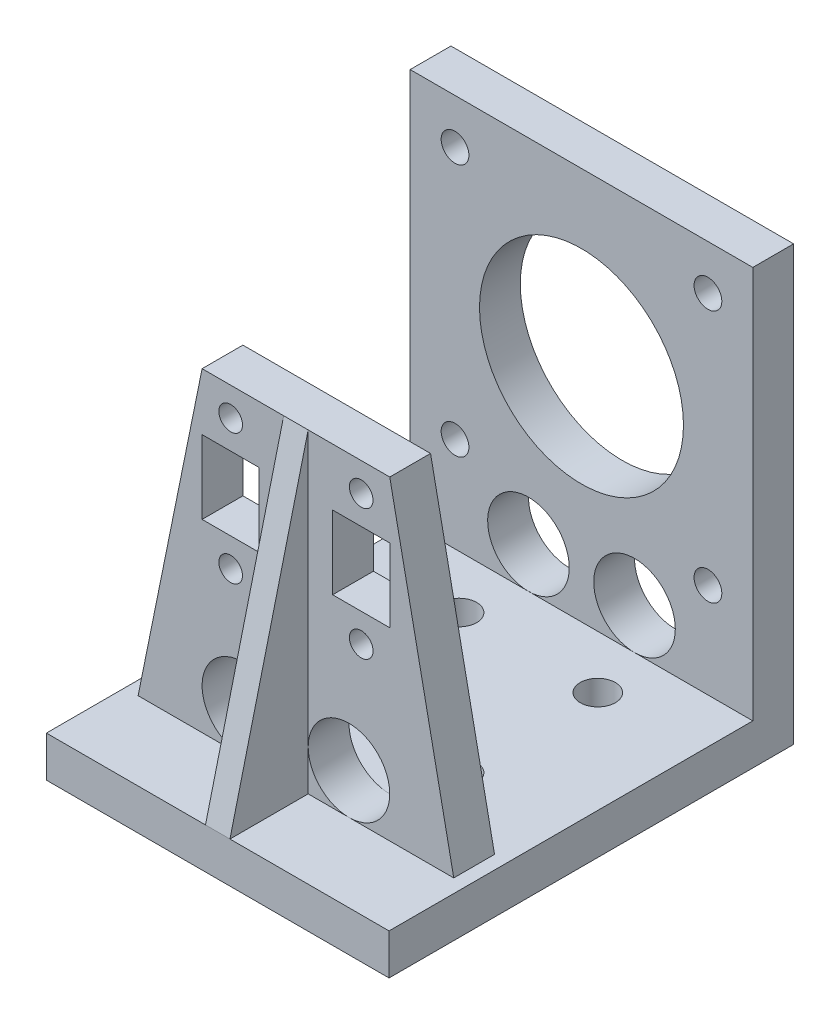
from build123d import *

# Parameters (mm, degrees)
MOTOR_MOUNT_SOLID_DEPTH                   = 7.5
ENCODER_DISTANCE_SKETCH_W                 = 50
ENCODER_DISTANCE_SKETCH_H                 = 45
ENCODER_DISTANCE_SOLID_DEPTH              = 5
ENCODER_MOUNT_SKETCH_R                    = 1.45
ENCODER_MOUNT_SKETCH_W                    = 7
ENCODER_MOUNT_SKETCH_H                    = 9
ENCODER_MOUNT_SOLID_DEPTH                 = 5
MOTOR_CLAMP_MOUNTING_HOLES_CUT_DEPTH      = 78.661122835
MOTOR_CLAMP_MOUNTING_HOLES_CUT_DEPTH_BACK = 78.661122835
MOTOR_CLAMP_MOUNTING_HOLES_SKETCH_R       = 1.45
GUSSET_PLATE_SKETCH_W                     = 50
GUSSET_PLATE_SKETCH_H                     = 5
GUSSET_PLATE_SOLID_DEPTH                  = 16.5
GUSSET_SOLID_DEPTH                        = 1.5
MOUNTING_PLATE_SKETCH_W                   = 50
MOUNTING_PLATE_SKETCH_H                   = 92
MOUNTING_PLATE_SKETCH_R                   = 2.65
MOUNTING_PLATE_SOLID_DEPTH                = 5
MOUNTING_HOLES_CUT_DEPTH                  = 93.348524623
MOUNTING_HOLES_CUT_DEPTH_BACK             = 93.348524623
MOUNTING_HOLE_SKETCH_R                    = 2.65
MOUNTING_PLATE_TRIM_SKETCH_W              = 50
MOUNTING_PLATE_TRIM_SKETCH_H              = 25.5
MOUNTING_PLATE_TRIM_SKETCH_H_2            = 30
MOUNTING_PLATE_TRIM_SKETCH_W_2            = 23.5
MOUNTING_PLATE_TRIM_SKETCH_H_3            = 16.5
MOUNTING_PLATE_TRIM_CUT_DEPTH             = 2
CUT_EXTRUDE1_DEPTH                        = 93.990590922
CUT_EXTRUDE1_DEPTH_BACK                   = 93.990590922
SKETCH2_W                                 = 50
SKETCH2_H                                 = 120
SKETCH2_W_2                               = 42
SKETCH2_H_2                               = 54.272597004
SKETCH3_W                                 = 42
SKETCH3_H                                 = 59.586450004
BOSS_EXTRUDE1_DEPTH                       = 5
CUT_EXTRUDE2_DEPTH                        = 69.16716098
CUT_EXTRUDE2_DEPTH_BACK                   = 69.16716098
SKETCH4_R                                 = 2.15
SKETCH5_W                                 = 42
SKETCH5_H                                 = 42
BOSS_EXTRUDE2_DEPTH                       = 5
SKETCH6_W                                 = 42
SKETCH6_H                                 = 53.136298502
CUT_EXTRUDE3_DEPTH                        = 10
SKETCH7_R                                 = 12.5
SKETCH7_R_2                               = 1.7
CUT_EXTRUDE4_DEPTH                        = 5
SKETCH8_R                                 = 5
CUT_EXTRUDE5_DEPTH                        = 56.441335495


with BuildPart() as part:
    # Mouting Mount Sketch → Motor Mount Solid (new, symmetric)
    with BuildSketch(Plane.XY):
        with BuildLine():
            Line((-25, -55), (25, -55))
            Line((25, -55), (25, 0))
            Line((25, 0), (10, 0))
            ThreePointArc((10, 0), (0, -10), (-10, 0))
            Line((-10, 0), (-25, 0))
            Line((-25, 0), (-25, -55))
        make_face()
    extrude(amount=MOTOR_MOUNT_SOLID_DEPTH, both=True)

    # Encoder Distance Sketch → Encoder Distance Solid (add)
    with BuildSketch(Plane.XZ.offset(55)):
        with Locations((0, 15)):
            Rectangle(ENCODER_DISTANCE_SKETCH_W, ENCODER_DISTANCE_SKETCH_H)
    extrude(amount=ENCODER_DISTANCE_SOLID_DEPTH)

    # Encoder Mount Sketch → Encoder Mount Solid (add)
    with BuildSketch(Plane.XY.offset(37.5)):
        Polygon((-25, -60), (-25, -55), (-11.5, 11.5), (11.5, 11.5), (25, -55), (25, -60), align=None)
        with Locations((-8, 8)):
            Circle(ENCODER_MOUNT_SKETCH_R, mode=Mode.SUBTRACT)
        with Locations((8, 8)):
            Circle(ENCODER_MOUNT_SKETCH_R, mode=Mode.SUBTRACT)
        with Locations((-8, -8)):
            Circle(ENCODER_MOUNT_SKETCH_R, mode=Mode.SUBTRACT)
        with Locations((8, -8)):
            Circle(ENCODER_MOUNT_SKETCH_R, mode=Mode.SUBTRACT)
        with Locations((-8, 0)):
            Rectangle(ENCODER_MOUNT_SKETCH_W, ENCODER_MOUNT_SKETCH_H, mode=Mode.SUBTRACT)
        with Locations((8, 0)):
            Rectangle(ENCODER_MOUNT_SKETCH_W, ENCODER_MOUNT_SKETCH_H, mode=Mode.SUBTRACT)
    extrude(amount=ENCODER_MOUNT_SOLID_DEPTH)

    # Motor Clamp Mounting Holes Sketch → Motor Clamp Mounting Holes Cut (cut, two sides: drawn at the far end of the back side and taken through both)
    with BuildSketch(Plane(origin=(0, 0, 0), x_dir=(1, 0, 0), z_dir=(0, 1, 0)).offset(-MOTOR_CLAMP_MOUNTING_HOLES_CUT_DEPTH_BACK)):
        with Locations(Location((-15, 0, 0), (0, 0, 180))):
            Circle(MOTOR_CLAMP_MOUNTING_HOLES_SKETCH_R)
        with Locations(Location((15, 0, 0), (0, 0, 180))):
            Circle(MOTOR_CLAMP_MOUNTING_HOLES_SKETCH_R)
    extrude(amount=MOTOR_CLAMP_MOUNTING_HOLES_CUT_DEPTH + MOTOR_CLAMP_MOUNTING_HOLES_CUT_DEPTH_BACK, mode=Mode.SUBTRACT)

    # Gusset Plate Sketch → Gusset Plate Solid (add)
    with BuildSketch(Plane.XY.offset(42.5)):
        with Locations((0, -57.5)):
            Rectangle(GUSSET_PLATE_SKETCH_W, GUSSET_PLATE_SKETCH_H)
    extrude(amount=GUSSET_PLATE_SOLID_DEPTH)

    # Gusset Sketch → Gusset Solid (add, symmetric)
    with BuildSketch(Plane(origin=(0, 0, 0), x_dir=(0, 0, -1), z_dir=(1, 0, 0))):
        Polygon((-42.5, 11.5), (-59, -55), (-42.5, -55), align=None)
    extrude(amount=GUSSET_SOLID_DEPTH, both=True)

    # Mounting Plate Sketch → Mounting Plate Solid (add)
    with BuildSketch(Plane(origin=(0, -55, 0), x_dir=(1, 0, 0), z_dir=(0, 1, 0))):
        with Locations((0, -13)):
            Rectangle(MOUNTING_PLATE_SKETCH_W, MOUNTING_PLATE_SKETCH_H)
        with Locations((-19, -53)):
            Circle(MOUNTING_PLATE_SKETCH_R, mode=Mode.SUBTRACT)
        with Locations((19, -53)):
            Circle(MOUNTING_PLATE_SKETCH_R, mode=Mode.SUBTRACT)
        with Locations(Location((-19, 27, 0), (0, 0, 270))):
            Circle(MOUNTING_PLATE_SKETCH_R, mode=Mode.SUBTRACT)
        with Locations(Location((19, 27, 0), (0, 0, 270))):
            Circle(MOUNTING_PLATE_SKETCH_R, mode=Mode.SUBTRACT)
    extrude(amount=-MOUNTING_PLATE_SOLID_DEPTH)

    # Mounting Hole Sketch → Mounting Holes Cut (cut, two sides: drawn at the far end of the back side and taken through both)
    with BuildSketch(Plane(origin=(0, -55, 0), x_dir=(1, 0, 0), z_dir=(0, 1, 0)).offset(-MOUNTING_HOLES_CUT_DEPTH_BACK)):
        with Locations(Location((-19, 27, 0), (0, 0, 270))):
            Circle(MOUNTING_HOLE_SKETCH_R)
        with Locations(Location((19, 27, 0), (0, 0, 270))):
            Circle(MOUNTING_HOLE_SKETCH_R)
        with Locations(Location((19, -53, 0), (0, 0, 90))):
            Circle(MOUNTING_HOLE_SKETCH_R)
        with Locations(Location((-19, -53, 0), (0, 0, 90))):
            Circle(MOUNTING_HOLE_SKETCH_R)
    extrude(amount=MOUNTING_HOLES_CUT_DEPTH + MOUNTING_HOLES_CUT_DEPTH_BACK, mode=Mode.SUBTRACT)

    # Mounting Plate Trim Sketch → Mounting Plate Trim Cut (cut)
    with BuildSketch(Plane(origin=(0, -55, 0), x_dir=(1, 0, 0), z_dir=(0, 1, 0))):
        with Locations((0, 20.25)):
            Rectangle(MOUNTING_PLATE_TRIM_SKETCH_W, MOUNTING_PLATE_TRIM_SKETCH_H)
        with Locations((0, -22.5)):
            Rectangle(MOUNTING_PLATE_TRIM_SKETCH_W, MOUNTING_PLATE_TRIM_SKETCH_H_2)
        with Locations((13.25, -50.75)):
            Rectangle(MOUNTING_PLATE_TRIM_SKETCH_W_2, MOUNTING_PLATE_TRIM_SKETCH_H_3)
        with Locations((-13.25, -50.75)):
            Rectangle(MOUNTING_PLATE_TRIM_SKETCH_W_2, MOUNTING_PLATE_TRIM_SKETCH_H_3)
    extrude(amount=-MOUNTING_PLATE_TRIM_CUT_DEPTH, mode=Mode.SUBTRACT)

    # Sketch2 → Cut-Extrude1 (cut, two sides: drawn at the far end of the back side and taken through both)
    with BuildSketch(Plane(origin=(0, 0, -7.5), x_dir=(-1, 0, 0), z_dir=(0, 0, -1)).offset(-CUT_EXTRUDE1_DEPTH_BACK)):
        Rectangle(SKETCH2_W, SKETCH2_H)
        Rectangle(SKETCH2_W_2, SKETCH2_H_2, mode=Mode.SUBTRACT)
    extrude(amount=CUT_EXTRUDE1_DEPTH + CUT_EXTRUDE1_DEPTH_BACK, mode=Mode.SUBTRACT)


with BuildPart() as cut_extrude1_piece_1:
    # of the separate pieces the step leaves, piece 1, a body of its own (cut_extrude1_pieces)
    add(part.part.solids().sort_by_distance((21, 0, 7.5))[0])



with BuildPart() as cut_extrude1_piece_2:
    # of the separate pieces the step leaves, piece 2, a body of its own (cut_extrude1_pieces)
    add(part.part.solids().sort_by_distance((-1.5, -27.136298502, 42.5))[0])


with BuildPart() as cut_extrude1_piece_1_1:
    add(cut_extrude1_piece_1.part)

    add(cut_extrude1_piece_2.part)  # Boss-Extrude1 merges Cut-Extrude1 piece 2
    # Sketch3 → Boss-Extrude1 (add)
    with BuildSketch(Plane.XZ.offset(27.136298502)):
        with Locations((0, 22.293225002)):
            Rectangle(SKETCH3_W, SKETCH3_H)
    extrude(amount=BOSS_EXTRUDE1_DEPTH)

    # Sketch4 → Cut-Extrude2 (cut, two sides: drawn at the far end of the back side and taken through both)
    with BuildSketch(Plane(origin=(0, -27.136298502, 0), x_dir=(1, 0, 0), z_dir=(0, 1, 0)).offset(-CUT_EXTRUDE2_DEPTH_BACK)):
        with Locations(Location((-8.5, -14, 0), (0, 0, 270))):
            Circle(SKETCH4_R)
        with Locations(Location((8.5, -14, 0), (0, 0, 270))):
            Circle(SKETCH4_R)
        with Locations(Location((-8.5, -31, 0), (0, 0, 270))):
            Circle(SKETCH4_R)
        with Locations(Location((8.5, -31, 0), (0, 0, 270))):
            Circle(SKETCH4_R)
    extrude(amount=CUT_EXTRUDE2_DEPTH + CUT_EXTRUDE2_DEPTH_BACK, mode=Mode.SUBTRACT)

    # Sketch5 → Boss-Extrude2 (add)
    with BuildSketch(Plane.XY.offset(7.5)):
        Rectangle(SKETCH5_W, SKETCH5_H)
    extrude(amount=-BOSS_EXTRUDE2_DEPTH)

    # Sketch6 → Cut-Extrude3 (cut)
    with BuildSketch(Plane(origin=(0, 0, -7.5), x_dir=(-1, 0, 0), z_dir=(0, 0, -1))):
        with Locations((0, -5.568149251)):
            Rectangle(SKETCH6_W, SKETCH6_H)
    extrude(amount=-CUT_EXTRUDE3_DEPTH, mode=Mode.SUBTRACT)

    # Sketch7 → Cut-Extrude4 (cut)
    with BuildSketch(Plane(origin=(0, 0, 2.5), x_dir=(-1, 0, 0), z_dir=(0, 0, -1))):
        Circle(SKETCH7_R)
        with Locations((-15.5, 15.5)):
            Circle(SKETCH7_R_2)
        with Locations((15.5, 15.5)):
            Circle(SKETCH7_R_2)
        with Locations((-15.5, -15.5)):
            Circle(SKETCH7_R_2)
        with Locations((15.5, -15.5)):
            Circle(SKETCH7_R_2)
    extrude(amount=-CUT_EXTRUDE4_DEPTH, mode=Mode.SUBTRACT)

    # Sketch8 → Cut-Extrude5 (cut, through all)
    with BuildSketch(Plane.XY.offset(42.5)):
        with Locations((-6.5, -22.136298502)):
            Circle(SKETCH8_R)
        with Locations((6.5, -22.136298502)):
            Circle(SKETCH8_R)
    extrude(amount=-CUT_EXTRUDE5_DEPTH, mode=Mode.SUBTRACT)


solid = cut_extrude1_piece_1_1.part
